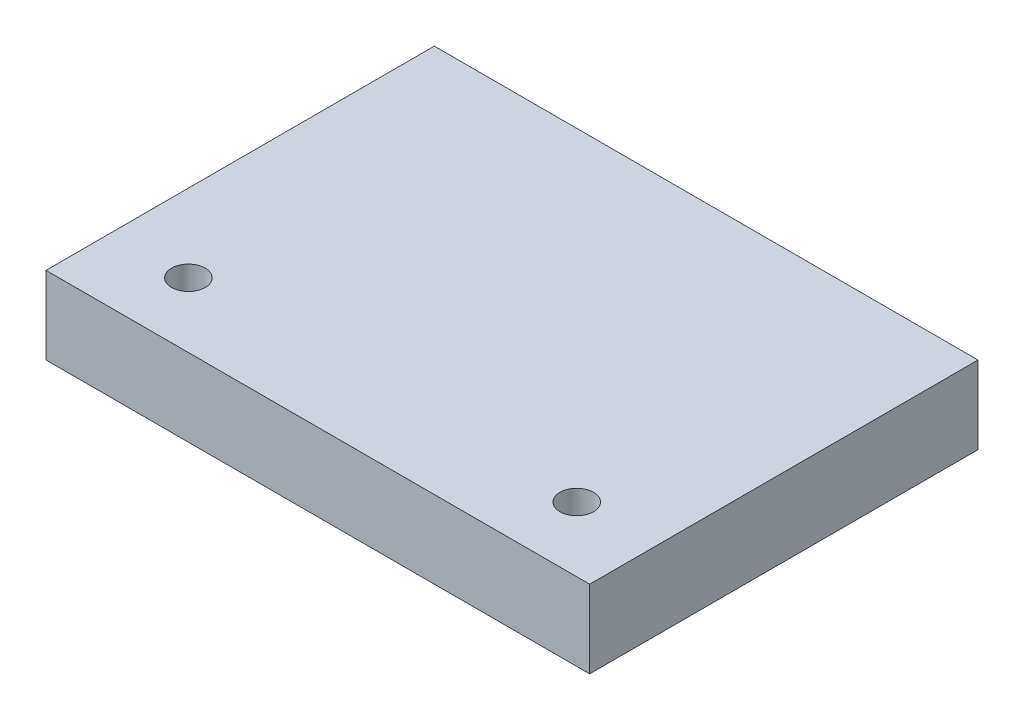
from build123d import *

# Parameters (mm, degrees)
SKETCH_1_W      = 21
SKETCH_1_H      = 15
EXTRUDE_1_DEPTH = 3
HOLE_WIZARD_1_D = 1.3


with BuildPart() as part:
    # 草图1 → 凸台-拉伸1 (new body)
    with BuildSketch(Plane(origin=(0, 0, 0), x_dir=(1, 0, 0), z_dir=(0, 1, 0))):
        Rectangle(SKETCH_1_W, SKETCH_1_H)
    extrude(amount=EXTRUDE_1_DEPTH)

    # 孔1 (through all)
    with Locations(Plane(origin=(0, 3, 0), x_dir=(1, 0, 0), z_dir=(0, 1, 0))):
        with Locations((-7.5, -5), (7.5, -5)):
            Hole(HOLE_WIZARD_1_D / 2)


solid = part.part
